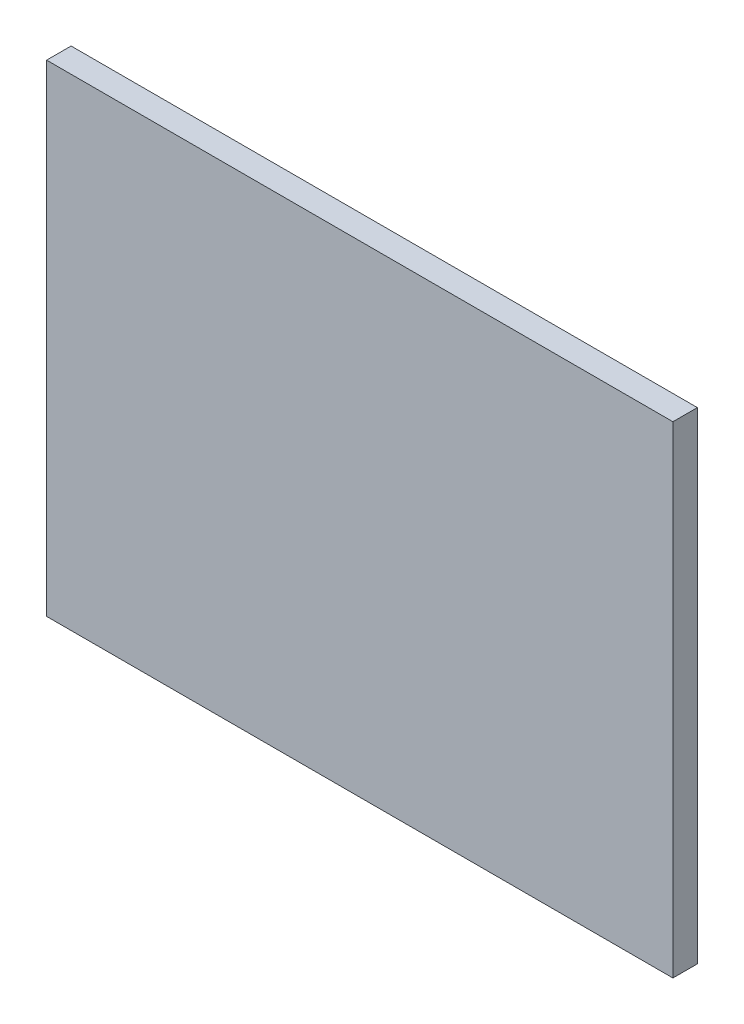
from build123d import *

# Parameters (mm, degrees)
SKETCH1_W           = 65
SKETCH1_H           = 50
BOSS_EXTRUDE1_DEPTH = 2.54


with BuildPart() as part:
    # Sketch1 → Boss-Extrude1 (new body)
    with BuildSketch(Plane.XY):
        Rectangle(SKETCH1_W, SKETCH1_H)
    extrude(amount=BOSS_EXTRUDE1_DEPTH)


solid = part.part
